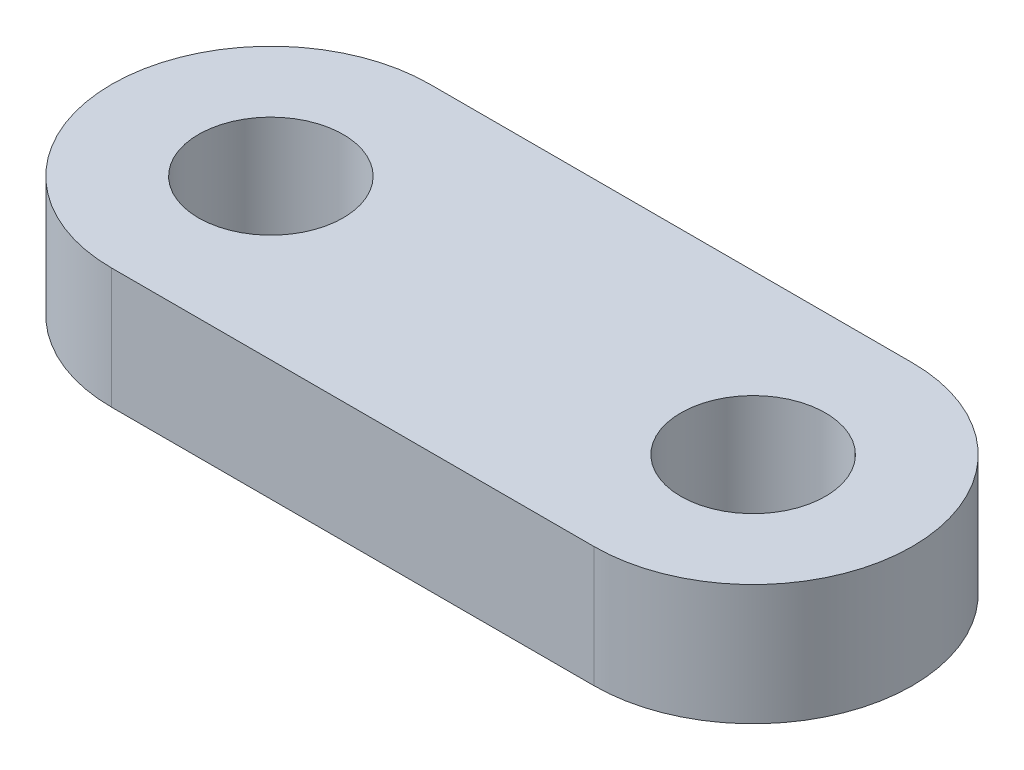
from build123d import *

# Parameters (mm, degrees)
SKETCH2_R           = 7.62
BOSS_EXTRUDE1_DEPTH = 12.7


with BuildPart() as part:
    # Sketch2 → Boss-Extrude1 (new body)
    with BuildSketch(Plane(origin=(0, 0, 0), x_dir=(1, 0, 0), z_dir=(0, 1, 0))):
        with BuildLine():
            Line((0, 16.764), (50.8, 16.764))
            ThreePointArc((50.8, 16.764), (67.564, 0), (50.8, -16.764))
            Line((50.8, -16.764), (0, -16.764))
            ThreePointArc((0, -16.764), (-16.764, 0), (0, 16.764))
        make_face()
        with Locations(Location((0, 0, 0), (0, 0, 270))):
            Circle(SKETCH2_R, mode=Mode.SUBTRACT)
        with Locations(Location((50.8, 0, 0), (0, 0, 270))):
            Circle(SKETCH2_R, mode=Mode.SUBTRACT)
    extrude(amount=BOSS_EXTRUDE1_DEPTH)


solid = part.part
